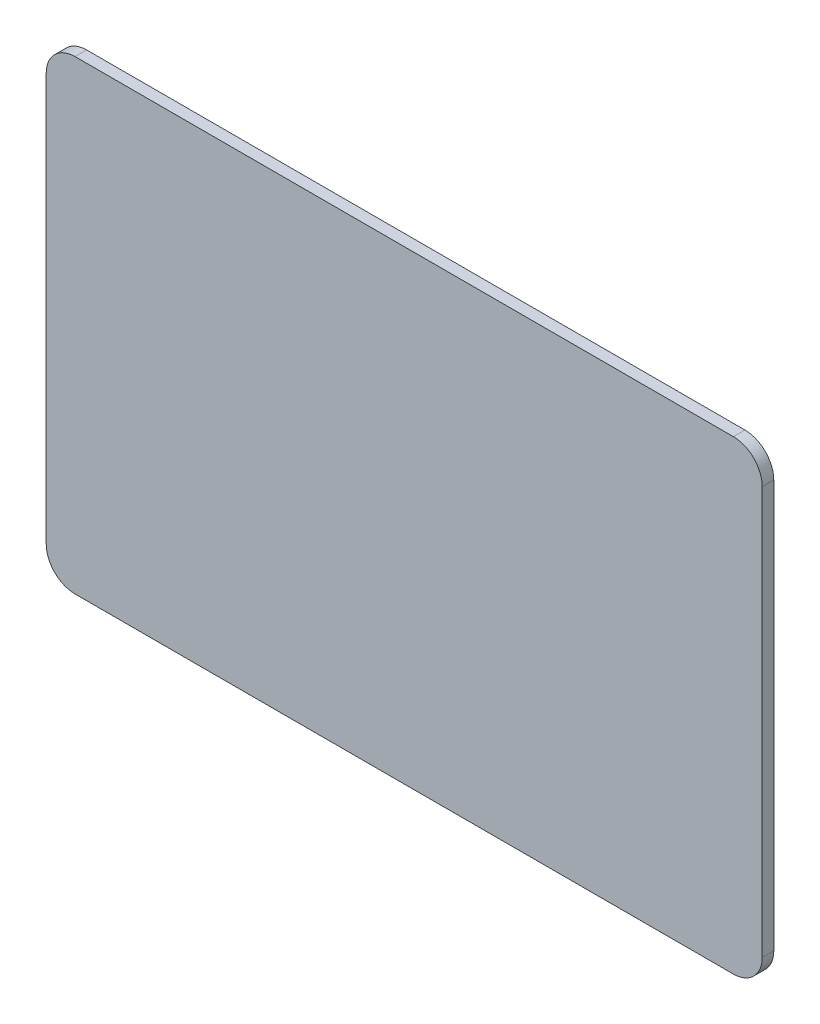
from build123d import *

# Parameters (mm, degrees)
RESSALTO_EXTRUS_O1_DEPTH = 1


with BuildPart() as part:
    # Esboço1 → Ressalto-extrusão1 (new body)
    with BuildSketch(Plane.XY):
        with BuildLine():
            Line((32.148439705, -17.528571429), (32.148439705, 17.771428571))
            ThreePointArc((32.148439705, 17.771428571), (31.416206658, 19.539195524), (29.648439705, 20.271428571))
            Line((29.648439705, 20.271428571), (-27.351560295, 20.271428571))
            ThreePointArc((-27.351560295, 20.271428571), (-29.119327248, 19.539195524), (-29.851560295, 17.771428571))
            Line((-29.851560295, 17.771428571), (-29.851560295, -17.528571429))
            ThreePointArc((-29.851560295, -17.528571429), (-29.119327248, -19.296338382), (-27.351560295, -20.028571429))
            Line((-27.351560295, -20.028571429), (29.648439705, -20.028571429))
            ThreePointArc((29.648439705, -20.028571429), (31.416206658, -19.296338382), (32.148439705, -17.528571429))
        make_face()
    extrude(amount=RESSALTO_EXTRUS_O1_DEPTH)


solid = part.part
